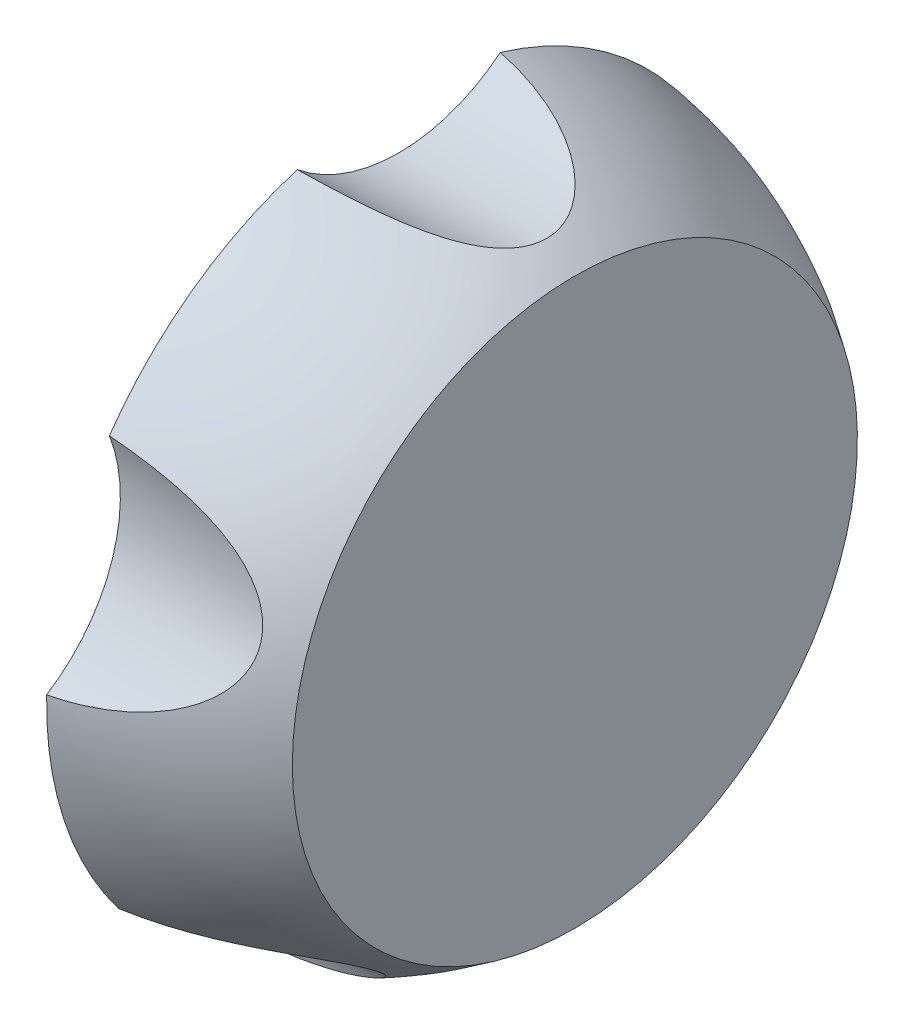
from build123d import *

# Parameters (mm, degrees)
SKETCH2_R          = 63.5
CUT_EXTRUDE2_DEPTH = 69.85


with BuildPart() as part:
    # Sketch1 → Revolve1 (revolve)
    with BuildSketch(Plane.XY, mode=Mode.PRIVATE) as revolve1_sk:
        with BuildLine():
            Line((0, 38.1), (50.8, 38.1))
            Line((50.8, 38.1), (50.8, 0))
            Line((50.8, 0), (69.85, 0))
            Line((69.85, 0), (69.85, 112.066794433))
            ThreePointArc((69.85, 112.066794433), (36.654204879, 130.254405152), (0, 139.7))
            Line((0, 139.7), (0, 38.1))
        make_face()
    revolve(revolve1_sk.sketch.rotate(Axis((50.8, 0, 0), (1, 0, 0)), 90), axis=Axis((50.8, 0, 0), (1, 0, 0)))

    # Sketch2 → Cut-Extrude2 (cut)
    with BuildSketch(Plane(origin=(69.85, 0, 0), x_dir=(0, 0, -1), z_dir=(1, 0, 0))):
        with Locations((0, 182.890391327)):
            Circle(SKETCH2_R)
        with Locations((173.93909844, 56.516239028)):
            Circle(SKETCH2_R)
        with Locations((107.500274808, -147.961434692)):
            Circle(SKETCH2_R)
        with Locations((-107.500274808, -147.961434692)):
            Circle(SKETCH2_R)
        with Locations((-173.93909844, 56.516239028)):
            Circle(SKETCH2_R)
    extrude(amount=-CUT_EXTRUDE2_DEPTH, mode=Mode.SUBTRACT)


solid = part.part
